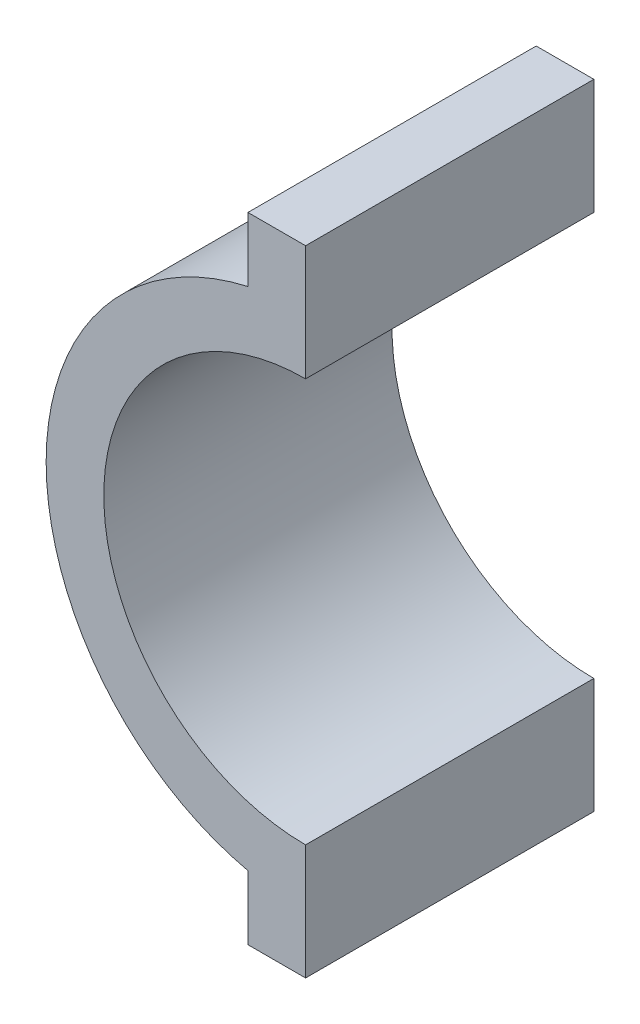
from build123d import *

# Parameters (mm, degrees)
BOSS_EXTRUDE1_DEPTH = 25


with BuildPart() as part:
    # Sketch4 → Boss-Extrude1 (new body)
    with BuildSketch(Plane.XY):
        with BuildLine():
            Line((0, 22.5), (0, 17.5))
            ThreePointArc((0, 17.5), (-17.5, 0), (0, -17.5))
            Line((0, -17.5), (0, -22.5))
            Line((0, -22.5), (0, -27.5))
            Line((0, -27.5), (-5, -27.5))
            Line((-5, -27.5), (-5, -22.5))
            Line((-5, -22.5), (-5, -21.937410968))
            ThreePointArc((-5, -21.937410968), (-22.5, 0), (-5, 21.937410968))
            Line((-5, 21.937410968), (-5, 22.5))
            Line((-5, 22.5), (-5, 27.5))
            Line((-5, 27.5), (0, 27.5))
            Line((0, 27.5), (0, 22.5))
        make_face()
    extrude(amount=BOSS_EXTRUDE1_DEPTH)


solid = part.part
